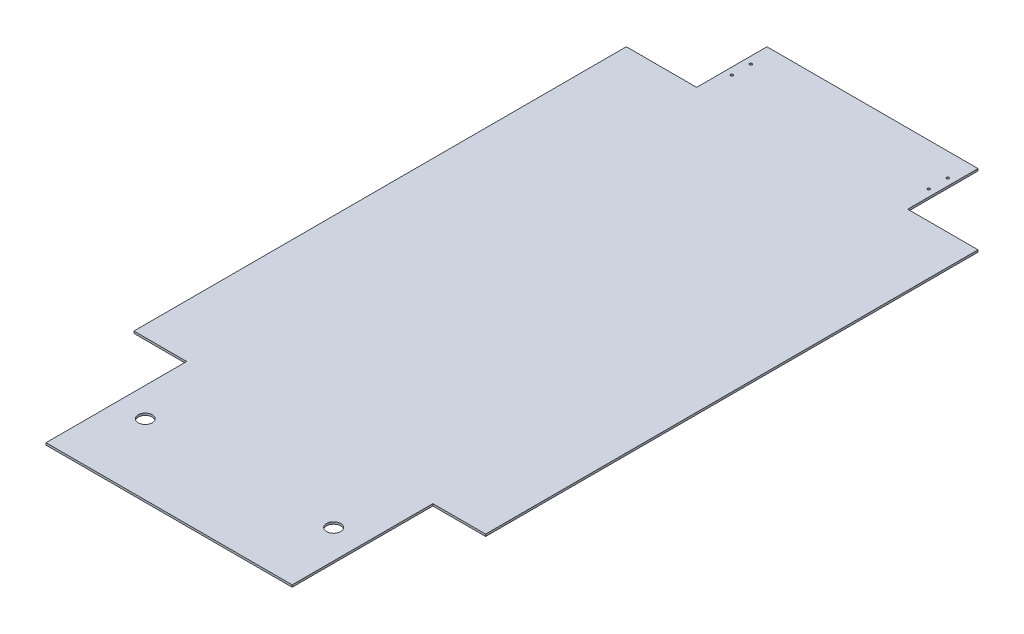
from build123d import *

# Parameters (mm, degrees)
SKETCH1_R           = 10
SKETCH1_R_2         = 1.778
BOSS_EXTRUDE1_DEPTH = 3


with BuildPart() as part:
    # Sketch1 → Boss-Extrude1 (new body)
    with BuildSketch(Plane(origin=(0, 0, 0), x_dir=(1, 0, 0), z_dir=(0, 1, 0))):
        Polygon((-250, -300), (-250, 400), (-150, 400), (-150, 500), (150, 500), (150, 400), (250, 400), (250, -300), (175, -300), (175, -500), (-175, -500), (-175, -300), align=None)
        with Locations(Location((133.9, -400, 0), (0, 0, 270))):
            Circle(SKETCH1_R, mode=Mode.SUBTRACT)
        with Locations(Location((-133.9, -400, 0), (0, 0, 90))):
            Circle(SKETCH1_R, mode=Mode.SUBTRACT)
        with Locations(Location((140, 466.9494, 0), (0, 0, 270))):
            Circle(SKETCH1_R_2, mode=Mode.SUBTRACT)
        with Locations(Location((140, 440, 0), (0, 0, 270))):
            Circle(SKETCH1_R_2, mode=Mode.SUBTRACT)
        with Locations(Location((-140, 466.9494, 0), (0, 0, 90))):
            Circle(SKETCH1_R_2, mode=Mode.SUBTRACT)
        with Locations(Location((-140, 440, 0), (0, 0, 90))):
            Circle(SKETCH1_R_2, mode=Mode.SUBTRACT)
    extrude(amount=BOSS_EXTRUDE1_DEPTH)


solid = part.part
